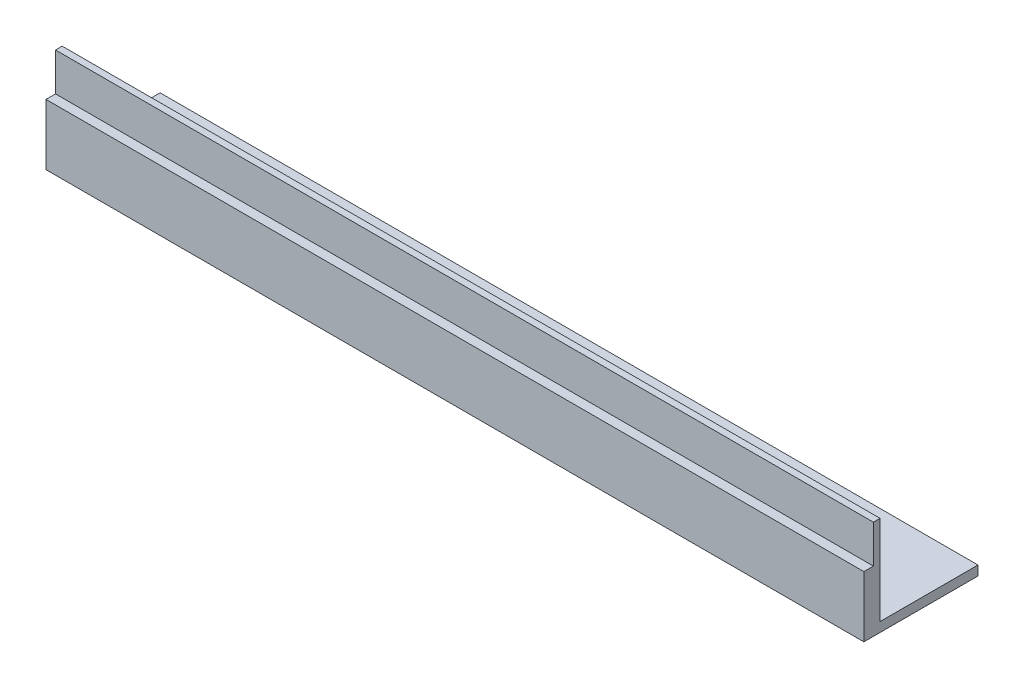
from build123d import *

# Parameters (mm, degrees)
BOSS_EXTRUDE1_DEPTH = 215


with BuildPart() as part:
    # Sketch2 → Boss-Extrude1 (new body)
    with BuildSketch(Plane(origin=(0, 0, 0), x_dir=(0, 0, -1), z_dir=(1, 0, 0))):
        Polygon((-27.5, 1.75), (-30, 1.75), (-30, -14.25), (0, -14.25), (0, -11.75), (-25.75, -11.75), (-25.75, 11.75), (-27.5, 11.75), (-27.5, 9.25), align=None)
    extrude(amount=BOSS_EXTRUDE1_DEPTH)


solid = part.part
